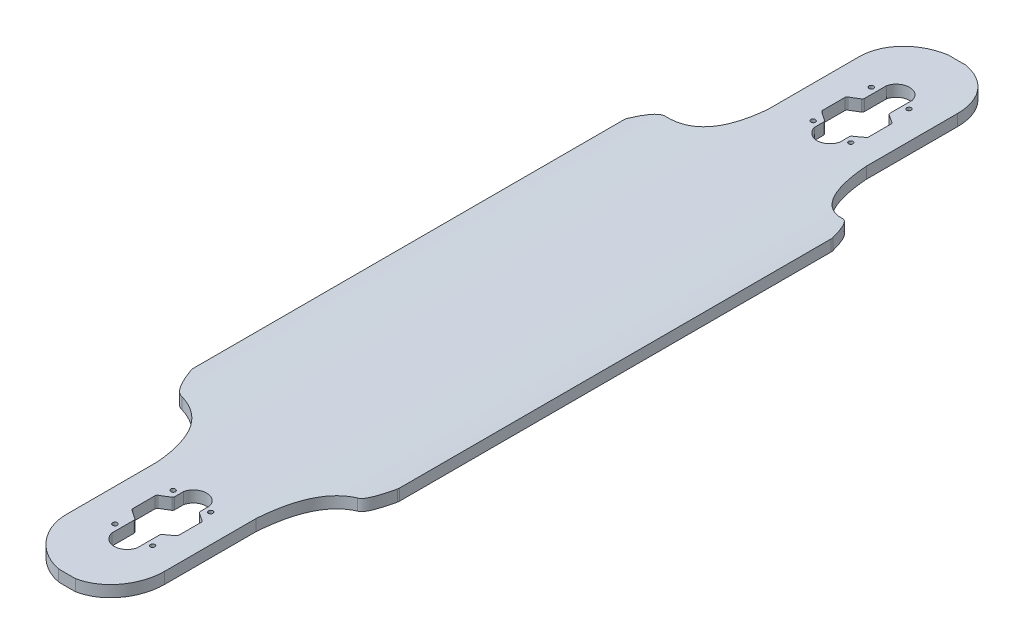
from build123d import *

# Parameters (mm, degrees)
BOSS_EXTRUDE1_DEPTH = 482.59999999999997
BOSS_EXTRUDE2_START = 98.425
BOSS_EXTRUDE2_DEPTH = 98.425
BOSS_EXTRUDE3_START = 254
BOSS_EXTRUDE3_DEPTH = 254
BOSS_EXTRUDE4_DEPTH = 254
BOSS_EXTRUDE5_DEPTH = 98.425
CUT_EXTRUDE1_DEPTH  = 98.425
SKETCH8_R           = 2.5399999999999943
SKETCH8_R_2         = 2.539999999999985
SKETCH8_R_3         = 2.5399999999999983
SKETCH8_R_4         = 2.539999999999981
SKETCH8_R_5         = 2.539999999999982
SKETCH8_R_6         = 2.539999999999969
CUT_EXTRUDE2_DEPTH  = 30.480000000000004
FILLET2_R           = 2.54
FILLET1_R           = 7.62


with BuildPart() as part:
    # Sketch1 → Boss-Extrude1 (new body)
    with BuildSketch(Plane.XY):
        with BuildLine():
            ThreePointArc((230.18750000000014, -12.7), (115.09375000000016, -25.399999708217024), (1.3303e-13, -12.7))
            Line((1.3303e-13, -12.7), (0, 0))
            ThreePointArc((0, 0), (115.09375000000003, -12.699999708216978), (230.1875, 0))
            Line((230.1875, 0), (230.18750000000014, -12.7))
        make_face()
    extrude(amount=BOSS_EXTRUDE1_DEPTH)

    # Sketch2 → Boss-Extrude2 (add)
    with BuildSketch(Plane(origin=(0, 0, 0), x_dir=(-1, 0, 0), z_dir=(0, 0, -1)).offset(BOSS_EXTRUDE2_START)):
        with BuildLine():
            ThreePointArc((-169.86250000000015, -9.851059053133781), (-200.16770645953937, -5.799422082207116), (-230.1875, 0))
            Line((-230.1875, 0), (-230.18750000000014, -12.7))
            ThreePointArc((-230.18750000000014, -12.700000000000045), (-200.16770645953937, -18.499422082206934), (-169.86250000000013, -22.551059053133486))
            Line((-169.86250000000015, -22.551059053133592), (-169.86250000000015, -19.049999708216802))
            Line((-169.86250000000015, -19.049999708216802), (-169.86250000000015, -9.85105905313366))
        make_face()
        with BuildLine():
            ThreePointArc((0, 0), (-30.01979354046084, -5.799422082207116), (-60.32500000000019, -9.851059053133781))
            Line((-60.325000000000166, -9.85105905313366), (-60.325000000000166, -19.049999708216802))
            Line((-60.325000000000166, -19.049999708216802), (-60.325000000000166, -22.551059053133592))
            ThreePointArc((-60.32500000000017, -22.551059053133486), (-30.01979354046088, -18.499422082207047), (-5.684e-14, -12.700000000000045))
            Line((-1.3303e-13, -12.7), (0, 0))
        make_face()
    extrude(amount=-BOSS_EXTRUDE2_DEPTH)

    # Sketch3 → Boss-Extrude3 (add)
    with BuildSketch(Plane(origin=(0, 0, 0), x_dir=(-1, 0, 0), z_dir=(0, 0, -1)).offset(BOSS_EXTRUDE3_START)):
        with BuildLine():
            Line((-169.86250000000015, -9.85105905313377), (-169.86250000000015, -22.551059053133816))
            ThreePointArc((-169.86250000000015, -22.551059053133816), (-115.0937500000001, -25.399999708217024), (-60.325000000000166, -22.551059053133816))
            Line((-60.325000000000166, -22.551059053133816), (-60.325000000000166, -9.85105905313377))
            ThreePointArc((-60.325000000000166, -9.85105905313377), (-115.0937500000002, -12.699999708216978), (-169.86250000000015, -9.85105905313377))
        make_face()
    extrude(amount=-BOSS_EXTRUDE3_DEPTH)

    # Sketch4 → Boss-Extrude4 (add)
    with BuildSketch(Plane.XY.offset(482.59999999999997)):
        with BuildLine():
            ThreePointArc((169.8625, -9.851059053133667), (115.09375, -12.699999708216865), (60.32500000000002, -9.851059053133554))
            Line((60.324999999999974, -9.85105905313366), (60.32499999999996, -22.551059053133816))
            ThreePointArc((60.32499999999997, -22.55105905313377), (115.09375, -25.399999708216967), (169.86250000000004, -22.551059053133883))
            Line((169.86249999999998, -22.551059053133816), (169.86249999999998, -9.85105905313377))
        make_face()
    extrude(amount=BOSS_EXTRUDE4_DEPTH)

    # Sketch5 → Boss-Extrude5 (add)
    with BuildSketch(Plane.XY.offset(482.59999999999997)):
        with BuildLine():
            Line((0, 0), (1.3303e-13, -12.7))
            ThreePointArc((1.3303e-13, -12.7), (115.09375000000016, -25.399999708216967), (230.18750000000014, -12.7))
            Line((230.18750000000014, -12.7), (230.1875, 0))
            ThreePointArc((230.1875, 0), (115.09375000000003, -12.699999708216865), (0, 0))
        make_face()
    extrude(amount=BOSS_EXTRUDE5_DEPTH)

    # Sketch6 → Cut-Extrude1 (cut)
    with BuildSketch(Plane(origin=(0, 0, 0), x_dir=(-1, 0, 0), z_dir=(0, -1, 0))):
        with BuildLine():
            Line((-60.324999999999974, -736.5999999999999), (-60.32499999999997, -682.625))
            ThreePointArc((-60.32499999999994, -682.625), (-73.2102757559419, -717.915091552868), (-105.80314444586806, -736.6000000000001))
            Line((-105.80314444586807, -736.5999999999999), (-60.324999999999974, -736.5999999999999))
        make_face()
        with BuildLine():
            Line((-169.86249999999998, -736.5999999999999), (-124.38435555413189, -736.5999999999999))
            ThreePointArc((-124.3843555541319, -736.6000000000001), (-156.97722424405805, -717.915091552868), (-169.8625, -682.625))
            Line((-169.86249999999998, -682.625), (-169.86249999999998, -736.5999999999999))
        make_face()
        with BuildLine():
            add(Edge.make_bspline(
                [(-169.86249999999998, -581.025), (-175.13876451622016, -517.0259135470571), (-212.83209325396822, -510.9167162698411)],
                knots=[0, 0, 0, 0.8257211002132265, 0.8257211002132265, 0.8257211002132265], degree=2))
            add(Edge.make_bspline(
                [(-212.83209325396822, -510.9167162698411), (-221.5097966268928, -510.9167162698411), (-230.18749999999994, -482.5999999999999)],
                knots=[0, 0, 0, 1, 1, 1], degree=2))
            Line((-230.18749999999994, -482.5999999999999), (-230.18750000000043, -510.9167162698411))
            Line((-230.18750000000043, -510.9167162698411), (-230.1875, -581.025))
            Line((-230.1875, -581.025), (-169.86249999999998, -581.025))
        make_face()
        with BuildLine():
            add(Edge.make_bspline(
                [(-17.35540674603169, -510.9167162698411), (-8.677703373107125, -510.9167162698411), (1.398e-14, -482.5999999999999)],
                knots=[0, 0, 0, 1, 1, 1], degree=2))
            Line((1.398e-14, -482.5999999999999), (1.195e-14, -510.9167162698411))
            Line((1.195e-14, -510.9167162698411), (0, -581.025))
            Line((0, -581.025), (-60.32499999999996, -581.025))
            add(Edge.make_bspline(
                [(-60.32499999999996, -581.025), (-55.048735482398115, -517.0259135470335), (-17.35540674603169, -510.9167162698411)],
                knots=[0, 0, 0, 0.825721100213823, 0.825721100213823, 0.825721100213823], degree=2))
        make_face()
        with BuildLine():
            add(Edge.make_bspline(
                [(-60.32500000000019, 98.42499999999998), (-55.04873548239812, 34.42591354703347), (-17.355406746031782, 28.316716269841223)],
                knots=[0, 0, 0, 0.8257211002138217, 0.8257211002138217, 0.8257211002138217], degree=2))
            add(Edge.make_bspline(
                [(-17.355406746031782, 28.316716269841223), (-8.677703373107148, 28.316716269841248), (0, 0)],
                knots=[0, 0, 0, 1, 1, 1], degree=2))
            Line((0, 0), (9.714e-14, 98.425))
            Line((9.714e-14, 98.425), (-60.32500000000019, 98.42499999999998))
        make_face()
        with BuildLine():
            add(Edge.make_bspline(
                [(-212.83209325396822, 28.31671626984129), (-221.5097966268928, 28.316716269841248), (-230.18749999999994, 0)],
                knots=[0, 0, 0, 1, 1, 1], degree=2))
            Line((-230.18749999999994, 0), (-230.1875, 98.425))
            Line((-230.1875, 98.425), (-169.86250000000015, 98.425))
            add(Edge.make_bspline(
                [(-169.86250000000015, 98.425), (-175.1387645162212, 34.4259135470572), (-212.83209325396822, 28.31671626984129)],
                knots=[0, 0, 0, 0.8257211002132272, 0.8257211002132272, 0.8257211002132272], degree=2))
        make_face()
        with BuildLine():
            Line((-169.86250000000015, 254), (-169.86250000000015, 200.02499999999998))
            ThreePointArc((-169.86250000000015, 200.02499999999998), (-156.9772242440584, 235.315091552868), (-124.38435555413241, 254.00000000000023))
            Line((-124.3843555541324, 254), (-169.86250000000015, 254))
        make_face()
        with BuildLine():
            Line((-60.32500000000019, 254), (-105.80314444586791, 254))
            ThreePointArc((-105.8031444458679, 254.0000000000002), (-73.21027575594192, 235.315091552868), (-60.32500000000019, 200.02499999999998))
            Line((-60.32500000000019, 200.02499999999998), (-60.32500000000019, 254))
        make_face()
    extrude(amount=CUT_EXTRUDE1_DEPTH, mode=Mode.SUBTRACT)

    # Sketch8 → Cut-Extrude2 (cut)
    with BuildSketch(Plane(origin=(0, 0, 0), x_dir=(-1, 0, 0), z_dir=(0, -1, 0))):
        with BuildLine():
            ThreePointArc((-100.86975371724569, 109.85500081941541), (-115.09375000000001, 98.42499999999991), (-129.31774628275423, 109.8550008194154))
            Line((-129.31774628275423, 109.8550008194154), (-129.31774628275423, 121.28499999999998))
            Line((-129.31774628275423, 121.28499999999998), (-140.7477462827542, 128.90499999999997))
            Line((-140.7477462827542, 128.90499999999997), (-140.7477462827542, 156.337))
            Line((-140.7477462827542, 156.337), (-129.31774628275423, 163.95699999999997))
            Line((-129.31774628275423, 163.95699999999997), (-129.31774628275423, 189.86500081941537))
            ThreePointArc((-129.31774628275423, 189.86500081941537), (-115.09375000000001, 201.29499584735922), (-100.86975371724574, 189.86500081941537))
            Line((-100.86975371724574, 189.86500081941537), (-100.86975371724574, 163.95699999999994))
            Line((-100.86975371724574, 163.95699999999994), (-89.43975371724572, 156.33699999999996))
            Line((-89.43975371724572, 156.33699999999996), (-89.43975371724572, 128.90499999999997))
            Line((-89.43975371724572, 128.90499999999997), (-100.8697537172457, 121.28499999999998))
            Line((-100.8697537172457, 121.28499999999998), (-100.86975371724569, 109.85500081941541))
        make_face()
        with Locations(Location((-94.13875000000002, 114.93499999999999, 0), (0, 0, 270))):
            Circle(SKETCH8_R)
        with BuildLine():
            ThreePointArc((-100.86975371724569, -672.4650008194153), (-115.09374999999996, -683.8949958473592), (-129.31774628275411, -672.4650008194153))
            Line((-129.31774628275411, -672.4650008194153), (-129.31774628275411, -646.5569999999998))
            Line((-129.31774628275411, -646.5569999999998), (-140.7477462827541, -638.9369999999999))
            Line((-140.7477462827541, -638.9369999999999), (-140.7477462827541, -611.5049999999999))
            Line((-140.7477462827541, -611.5049999999999), (-129.31774628275411, -603.8849999999999))
            Line((-129.31774628275411, -603.8849999999999), (-129.31774628275411, -592.4550008194154))
            ThreePointArc((-129.31774628275411, -592.4550008194154), (-115.09374999999994, -581.0249999999999), (-100.86975371724563, -592.4550008194154))
            Line((-100.86975371724563, -592.4550008194154), (-100.86975371724564, -603.8849999999999))
            Line((-100.86975371724564, -603.8849999999999), (-89.43975371724567, -611.5049999999999))
            Line((-89.43975371724567, -611.5049999999999), (-89.43975371724567, -638.9369999999999))
            Line((-89.43975371724567, -638.9369999999999), (-100.86975371724569, -646.5569999999998))
            Line((-100.86975371724569, -646.5569999999998), (-100.86975371724569, -672.4650008194153))
        make_face()
        with Locations(Location((-136.04875, 179.70499999999998, 0), (0, 0, 270))):
            Circle(SKETCH8_R_2)
        with Locations(Location((-94.13875000000002, 179.70499999999998, 0), (0, 0, 270))):
            Circle(SKETCH8_R_3)
        with Locations(Location((-136.04875, 114.93499999999999, 0), (0, 0, 270))):
            Circle(SKETCH8_R_4)
        with Locations(Location((-94.13874999999996, -662.305, 0), (0, 0, 270))):
            Circle(SKETCH8_R_5)
        with Locations(Location((-136.0487499999999, -662.305, 0), (0, 0, 270))):
            Circle(SKETCH8_R_6)
        with Locations(Location((-94.13874999999996, -597.535, 0), (0, 0, 270))):
            Circle(SKETCH8_R_5)
        with Locations(Location((-136.0487499999999, -597.535, 0), (0, 0, 270))):
            Circle(SKETCH8_R_6)
    extrude(amount=CUT_EXTRUDE2_DEPTH, mode=Mode.SUBTRACT)

    # Fillet2
    fillet2_edges = [part.edges().sort_by_distance(p)[0] for p in [
        (100.8697537172457, -18.858324334332178, -121.28499999999998),
        (89.43975371724572, -18.426249184171922, -128.90499999999997),
        (89.43975371724572, -18.426249184171922, -156.33699999999996),
        (100.86975371724574, -18.85832433433218, -163.95699999999994),
        (129.31774628275423, -18.858324334332185, -121.28499999999998),
        (140.7477462827542, -18.426249184171933, -128.90499999999997),
        (140.7477462827542, -18.426249184171933, -156.337),
        (129.31774628275423, -18.858324334332185, -163.95699999999997),
        (140.7477462827541, -18.426249184171937, 638.9369999999999),
        (140.7477462827541, -18.426249184171937, 611.5049999999999),
        (89.43975371724567, -18.426249184171922, 638.9369999999999),
        (89.43975371724567, -18.426249184171922, 611.5049999999999),
        (129.31774628275411, -18.858324334332185, 646.5569999999998),
        (129.31774628275411, -18.858324334332185, 603.8849999999999),
        (100.86975371724569, -18.858324334332178, 646.5569999999998),
        (100.86975371724564, -18.858324334332174, 603.8849999999999),
    ]]
    fillet(fillet2_edges, radius=FILLET2_R)

    # Fillet1
    fillet1_edges = [part.edges().sort_by_distance(p)[0] for p in [
        (0, -6.350000000000027, 0),
        (-1.398e-14, -6.350000000000038, 482.5999999999999),
        (230.18749999999994, -6.350000000000027, 0),
        (230.18749999999994, -6.350000000000038, 482.5999999999999),
    ]]
    fillet(fillet1_edges, radius=FILLET1_R)


solid = part.part
